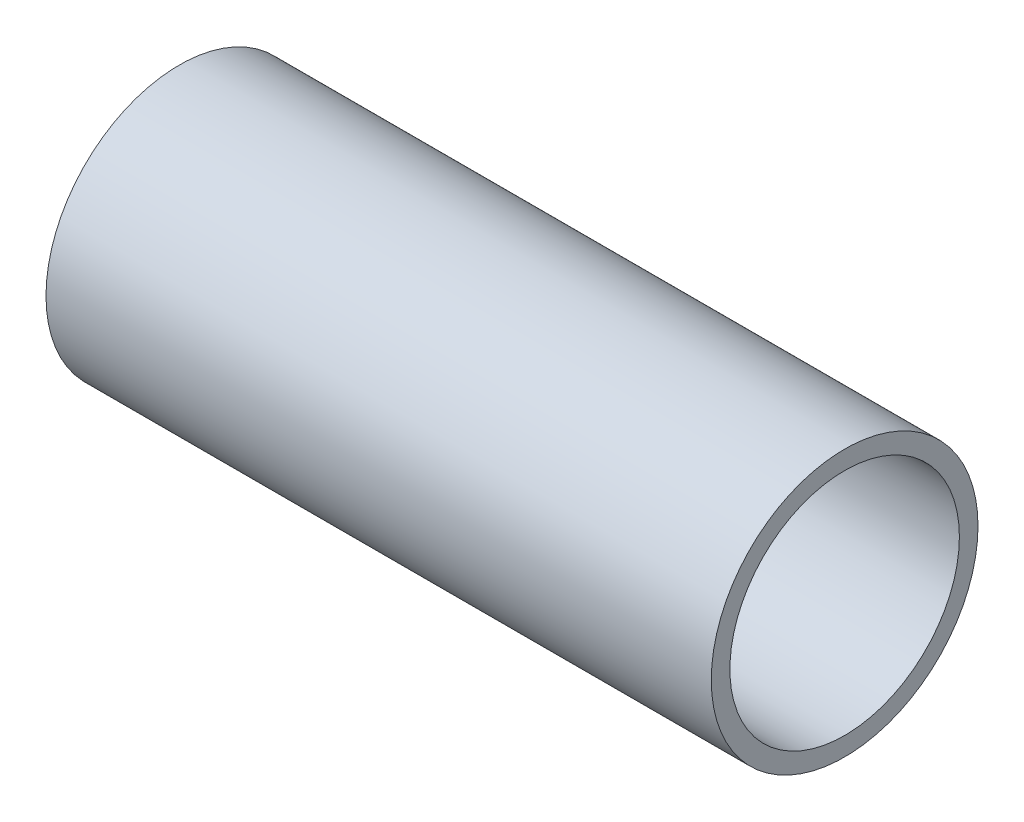
from build123d import *

# Parameters (mm, degrees)
SKETCH1_W = 214.5
SKETCH1_H = 6


with BuildPart() as part:
    # Sketch1 → Revolve1 (revolve)
    with BuildSketch(Plane(origin=(0, 0, 0), x_dir=(1, 0, 0), z_dir=(0, 1, 0))):
        with Locations((-107.25, 40)):
            Rectangle(SKETCH1_W, SKETCH1_H)
    revolve(axis=Axis((0, 0, 0), (-1, 0, 0)))


solid = part.part
